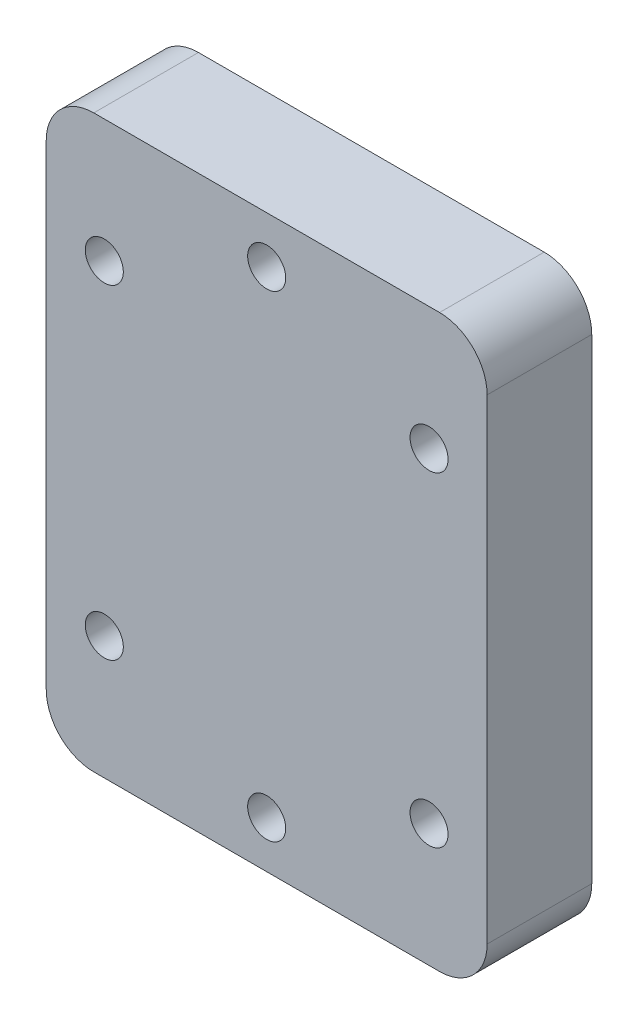
from build123d import *

# Parameters (mm, degrees)
BOSS_EXTRUDE1_DEPTH      = 2
BOSS_EXTRUDE1_DEPTH_BACK = 9
SKETCH1_W                = 46.35
SKETCH1_H                = 60
SKETCH1_R                = 2
SKETCH2_W                = 30
SKETCH2_H                = 30
CUT_EXTRUDE1_DEPTH       = 6.35
SKETCH4_R                = 2
BOSS_EXTRUDE4_DEPTH      = 0.85
FILLET1_R                = 5


with BuildPart() as part:
    # Sketch1 → Boss-Extrude1 (new, two sides: drawn at the far end of the back side and taken through both)
    with BuildSketch(Plane.XY.offset(-BOSS_EXTRUDE1_DEPTH_BACK)):
        Rectangle(SKETCH1_W, SKETCH1_H)
        with Locations((-17.071067812, 17.071067812)):
            Circle(SKETCH1_R, mode=Mode.SUBTRACT)
        with Locations((-17.071067812, -17.071067812)):
            Circle(SKETCH1_R, mode=Mode.SUBTRACT)
        with Locations((17.071067812, -17.071067812)):
            Circle(SKETCH1_R, mode=Mode.SUBTRACT)
        with Locations((17.071067812, 17.071067812)):
            Circle(SKETCH1_R, mode=Mode.SUBTRACT)
        with Locations((0, 25.060622825)):
            Circle(SKETCH1_R, mode=Mode.SUBTRACT)
        with Locations((0, -25.060622825)):
            Circle(SKETCH1_R, mode=Mode.SUBTRACT)
    extrude(amount=BOSS_EXTRUDE1_DEPTH + BOSS_EXTRUDE1_DEPTH_BACK)

    # Sketch2 → Cut-Extrude1 (cut)
    with BuildSketch(Plane(origin=(0, 0, -9), x_dir=(-1, 0, 0), z_dir=(0, 0, -1))):
        Rectangle(SKETCH2_W, SKETCH2_H)
    extrude(amount=-CUT_EXTRUDE1_DEPTH, mode=Mode.SUBTRACT)

    # Sketch4 → Boss-Extrude4 (add)
    with BuildSketch(Plane(origin=(0, 0, -9), x_dir=(-1, 0, 0), z_dir=(0, 0, -1))):
        with Locations((-17.071067812, 17.071067812)):
            Circle(SKETCH4_R)
        with Locations((17.071067812, 17.071067812)):
            Circle(SKETCH4_R)
        with Locations((-17.071067812, -17.071067812)):
            Circle(SKETCH4_R)
        with Locations((17.071067812, -17.071067812)):
            Circle(SKETCH4_R)
    extrude(amount=-BOSS_EXTRUDE4_DEPTH)

    # Fillet1
    fillet1_edges = [part.edges().sort_by_distance(p)[0] for p in [
        (-23.175, -30, -3.5),
        (-23.175, 30, -3.5),
        (23.175, 30, -3.5),
        (23.175, -30, -3.5),
    ]]
    fillet(fillet1_edges, radius=FILLET1_R)


solid = part.part
